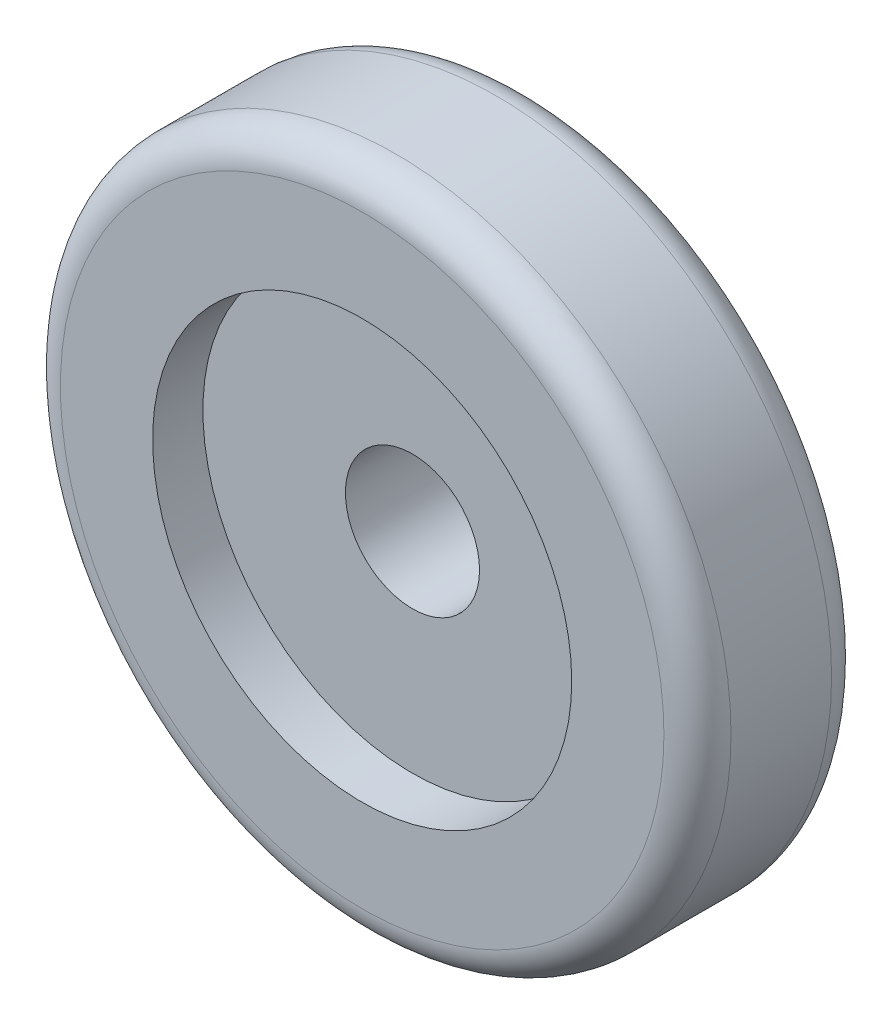
from build123d import *

# Parameters (mm, degrees)
SKETCH1_R           = 20
SKETCH1_R_2         = 4
BOSS_EXTRUDE1_DEPTH = 10
SKETCH2_R           = 12.5
CUT_EXTRUDE1_DEPTH  = 3
FILLET1_R           = 2


with BuildPart() as part:
    # Sketch1 → Boss-Extrude1 (new body)
    with BuildSketch(Plane.XY):
        Circle(SKETCH1_R)
        Circle(SKETCH1_R_2, mode=Mode.SUBTRACT)
    extrude(amount=BOSS_EXTRUDE1_DEPTH)

    # Sketch2 → Cut-Extrude1 (cut)
    with BuildSketch(Plane.XY.offset(10)):
        Circle(SKETCH2_R)
    extrude(amount=-CUT_EXTRUDE1_DEPTH, mode=Mode.SUBTRACT)

    # Fillet1
    fillet1_edges = [part.edges().sort_by_distance(p)[0] for p in [
        (-20, 0, 0),
        (-20, 0, 10),
    ]]
    fillet(fillet1_edges, radius=FILLET1_R)


solid = part.part
